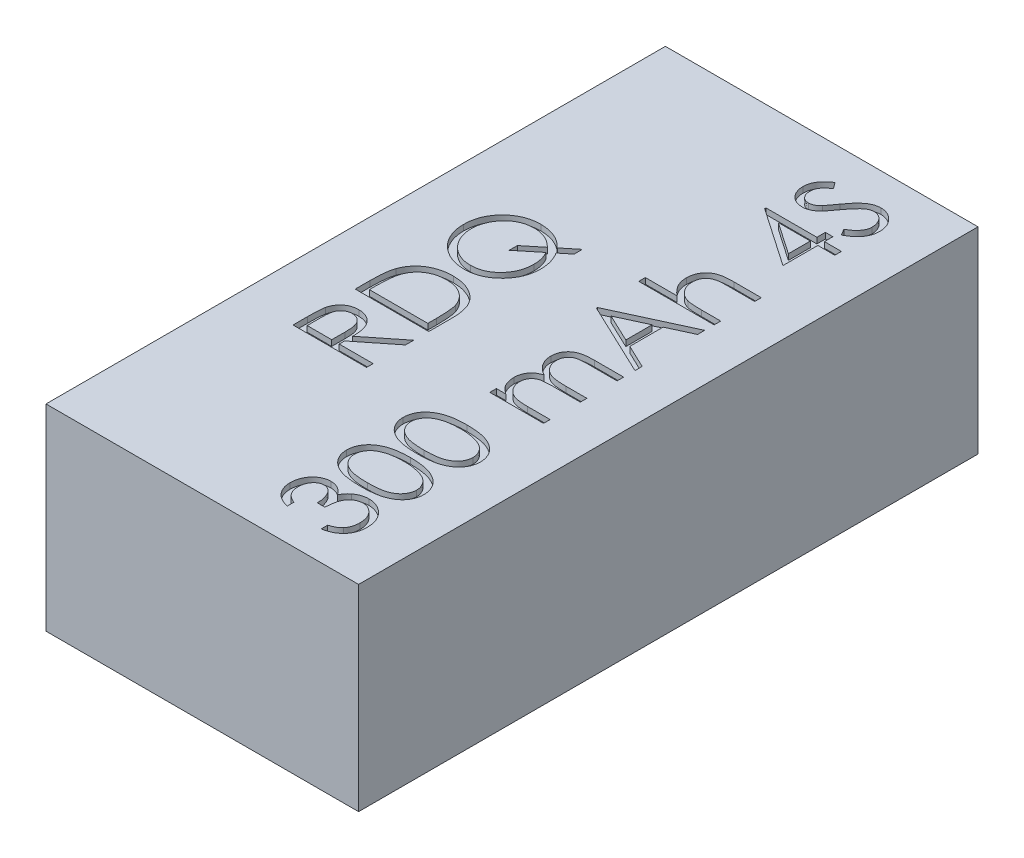
from build123d import *

# Parameters (mm, degrees)
SKETCH1_W           = 27
SKETCH1_H           = 17
BOSS_EXTRUDE1_DEPTH = 53.5
CUT_EXTRUDE1_DEPTH  = 0.5


with BuildPart() as part:
    # Sketch1 → Boss-Extrude1 (new body)
    with BuildSketch(Plane.XY):
        with Locations((13.5, 8.5)):
            Rectangle(SKETCH1_W, SKETCH1_H)
    extrude(amount=BOSS_EXTRUDE1_DEPTH)

    # Sketch2 → Cut-Extrude1 (cut)
    # profile 1 of 11: a face of its own
    with BuildSketch(Plane(origin=(0, 17, 0), x_dir=(1, 0, 0), z_dir=(0, 1, 0))):
        with BuildLine():
            Line((10.406206709, -19.747445913), (11.60191985, -18.771794872))
            Line((11.60191985, -18.771794872), (11.60191985, -19.48286258))
            Line((11.60191985, -19.48286258), (10.739479946, -20.187570112))
            add(Edge.make_bspline(
                [(10.739479946, -20.187570112), (10.782418115, -20.258253477), (10.867503496, -20.398318161), (10.977392537, -20.616638258), (11.06803695, -20.839707), (11.146009246, -21.065496785), (11.203793781, -21.296325169), (11.246365518, -21.530811258), (11.270512139, -21.769475586), (11.274349268, -21.929783476), (11.276278824, -22.010396635)],
                knots=[0, 0, 0, 0, 1.030168789, 2.04136103, 3.041061446, 4.02840172, 5.015006777, 6.002573162, 6.995564809, 8, 8, 8, 8], degree=3))
            add(Edge.make_bspline(
                [(11.276278824, -22.010396635), (11.273496896, -22.125894682), (11.268022889, -22.353160456), (11.220233775, -22.686934811), (11.14642769, -23.007307949), (11.039637627, -23.313641294), (10.903235123, -23.606268547), (10.735070294, -23.885053755), (10.537472418, -24.150138614), (10.311732858, -24.397610071), (10.06615966, -24.623897614), (9.803775776, -24.822450754), (9.528935149, -24.991274569), (9.240267237, -25.12777868), (8.940285096, -25.236112936), (8.626493868, -25.309939793), (8.300761509, -25.357727059), (8.07897747, -25.363232269), (7.966443087, -25.366025641)],
                knots=[0, 0, 0, 0, 1.055750571, 2.07740284, 3.077223765, 4.05828044, 5.038417088, 6.02463293, 7.030503776, 8.057169806, 9.083586829, 10.080154041, 11.061747002, 12.027853603, 12.995569715, 13.972756451, 14.971366004, 16, 16, 16, 16], degree=3))
            add(Edge.make_bspline(
                [(7.966443087, -25.366025641), (7.890910034, -25.365042274), (7.740374611, -25.363082448), (7.517034788, -25.33997161), (7.29764138, -25.306473604), (7.082736277, -25.257437263), (6.871816342, -25.195517113), (6.664986599, -25.118669394), (6.46230232, -25.028182825), (6.264961261, -24.924137817), (6.074652278, -24.809212849), (5.894685309, -24.682679828), (5.725163222, -24.546287519), (5.565669512, -24.40019703), (5.418398823, -24.242859139), (5.279607076, -24.077491459), (5.154569256, -23.899941739), (5.038493954, -23.714887828), (4.935670091, -23.521880677), (4.846796422, -23.322704854), (4.769732034, -23.119643795), (4.709209774, -22.910949503), (4.660281629, -22.698704214), (4.62668219, -22.48143921), (4.603496215, -22.259794893), (4.601596421, -22.110100199), (4.600637799, -22.034565304)],
                knots=[0, 0, 0, 0, 1.030594462, 2.053948123, 3.061601097, 4.058476009, 5.060194501, 6.06002193, 7.06782448, 8.087817635, 9.103219352, 10.100329444, 11.08825996, 12.071296, 13.049806814, 14.02795813, 15.015617367, 16.011298729, 17.008123238, 17.997713716, 18.986694736, 19.970122549, 20.961353313, 21.95757279, 22.969405538, 24, 24, 24, 24], degree=3))
            add(Edge.make_bspline(
                [(4.600637799, -22.034565304), (4.603405634, -21.919066735), (4.60884184, -21.692220154), (4.656639959, -21.359273962), (4.730735608, -21.039839872), (4.837005629, -20.734173507), (4.973661837, -20.442443145), (5.142000119, -20.165379482), (5.338128625, -19.900811605), (5.56399508, -19.65450724), (5.811294753, -19.430132681), (6.074192082, -19.230732299), (6.35260441, -19.063923676), (6.644362594, -18.926652713), (6.950112066, -18.820521203), (7.269925717, -18.746236596), (7.603336157, -18.698675844), (7.830595662, -18.693178436), (7.946090523, -18.690384615)],
                knots=[0, 0, 0, 0, 1.050621994, 2.063488829, 3.054696817, 4.03098776, 5.002868493, 5.980987983, 6.976572914, 7.995398336, 9.017077075, 10.011883961, 10.993309009, 11.965189742, 12.941480684, 13.932688673, 14.949378006, 16, 16, 16, 16], degree=3))
            add(Edge.make_bspline(
                [(7.946090523, -18.690384615), (8.006750826, -18.690977832), (8.126937047, -18.692153171), (8.305154379, -18.705785733), (8.479772419, -18.725373967), (8.650266553, -18.755281868), (8.817017405, -18.791322638), (8.979236862, -18.838193948), (9.138130919, -18.890627248), (9.344246905, -18.974947984), (9.594762943, -19.099191999), (9.881581448, -19.28161017), (10.155538793, -19.496654513), (10.321770783, -19.662968393), (10.406206709, -19.747445913)],
                knots=[0, 0, 0, 0, 0.791771681, 1.568736744, 2.332274839, 3.084898912, 3.827625132, 4.558351486, 5.288322611, 6.010973694, 7.464162711, 8.93230977, 10.441796527, 12, 12, 12, 12], degree=3))
        make_face()
        with BuildLine():
            add(Edge.make_bspline(
                [(9.936825699, -20.130328526), (9.866459833, -20.061048597), (9.728047054, -19.924771906), (9.501100655, -19.747867313), (9.265348533, -19.596256217), (9.017794377, -19.473424011), (8.760351686, -19.377503016), (8.492012681, -19.310194678), (8.214110715, -19.268359502), (8.025103686, -19.2629773), (7.929554065, -19.26025641)],
                knots=[0, 0, 0, 0, 1.052185505, 2.069695543, 3.06176622, 4.036333774, 5.010523718, 5.985353414, 6.981526144, 8, 8, 8, 8], degree=3))
            add(Edge.make_bspline(
                [(7.929554065, -19.26025641), (7.868019965, -19.260965986), (7.746377895, -19.262368691), (7.566368972, -19.281655862), (7.390335778, -19.308941473), (7.21859284, -19.348442675), (7.051488115, -19.399310516), (6.88924845, -19.462136769), (6.731350447, -19.535697362), (6.578774962, -19.621452941), (6.431743135, -19.715991211), (6.292053095, -19.821223903), (6.160425123, -19.935669808), (6.034690053, -20.058078656), (5.917439746, -20.190810488), (5.808724465, -20.333389278), (5.705913328, -20.484058134), (5.613113006, -20.643562626), (5.527797591, -20.807931958), (5.453919721, -20.976204341), (5.391347813, -21.146966844), (5.34061003, -21.319955033), (5.300672934, -21.494945059), (5.273417854, -21.672243715), (5.254150544, -21.851392507), (5.252664049, -21.97176033), (5.25191985, -22.032021234)],
                knots=[0, 0, 0, 0, 1.032958288, 2.041976502, 3.037103433, 4.023477888, 4.998866292, 5.968231228, 6.943073582, 7.921783703, 8.90545537, 9.876780072, 10.85618943, 11.833110341, 12.821898168, 13.827467856, 14.842673888, 15.88323808, 16.924703457, 17.951432745, 18.967462636, 19.976958182, 20.977218729, 21.979378626, 22.98839684, 24, 24, 24, 24], degree=3))
            add(Edge.make_bspline(
                [(5.25191985, -22.032021234), (5.252670105, -22.092704698), (5.254168686, -22.213915751), (5.273301032, -22.393934388), (5.30074079, -22.571621428), (5.340300314, -22.746306192), (5.391766313, -22.918053109), (5.45218511, -23.088192532), (5.526970747, -23.254426699), (5.609967846, -23.41807211), (5.703733242, -23.575441476), (5.807179674, -23.723811776), (5.916539015, -23.864867289), (6.035095472, -23.99634024), (6.163014821, -24.117714296), (6.296056544, -24.233567944), (6.439396527, -24.33734753), (6.589103208, -24.432974138), (6.745776686, -24.517830297), (6.906748473, -24.593353174), (7.072829486, -24.655606321), (7.242950622, -24.70634963), (7.416875656, -24.747882834), (7.595661067, -24.774637003), (7.778178075, -24.79407009), (7.901515391, -24.795453913), (7.963899017, -24.796153846)],
                knots=[0, 0, 0, 0, 1.013081393, 2.023560529, 3.020172014, 4.014894664, 5.012009234, 6.013339739, 7.027905139, 8.05406988, 9.076685265, 10.084431022, 11.073237316, 12.055989586, 13.037669622, 14.01702246, 15.000029851, 15.990179271, 16.982074564, 17.973767595, 18.957616416, 19.941159346, 20.937468857, 21.9410756, 22.95860252, 24, 24, 24, 24], degree=3))
            add(Edge.make_bspline(
                [(7.963899017, -24.796153846), (8.055614322, -24.793765382), (8.2360467, -24.789066534), (8.50098896, -24.750276283), (8.754875491, -24.684734781), (8.997961267, -24.594532223), (9.230611249, -24.479019366), (9.451737125, -24.337175248), (9.660349821, -24.16750518), (9.857792941, -23.977085381), (10.036596436, -23.767565232), (10.194185179, -23.545557419), (10.327177294, -23.312356558), (10.437353603, -23.069118633), (10.521452263, -22.814393974), (10.580693349, -22.549350232), (10.619354532, -22.273999289), (10.623098405, -22.086426668), (10.624996773, -21.991316106)],
                knots=[0, 0, 0, 0, 1.022486402, 2.011547069, 2.978383441, 3.941941744, 4.897799705, 5.869768277, 6.865262495, 7.891906405, 8.924879675, 9.932485585, 10.923702928, 11.914209426, 12.905618498, 13.909366795, 14.939923648, 16, 16, 16, 16], degree=3))
            add(Edge.make_bspline(
                [(10.624996773, -21.991316106), (10.624271322, -21.925971661), (10.622836431, -21.796724964), (10.603836454, -21.606080277), (10.576109227, -21.42040898), (10.537657398, -21.240203053), (10.483978671, -21.066183285), (10.422478846, -20.897026222), (10.348627307, -20.733199929), (10.290367575, -20.628993207), (10.26119469, -20.576812901)],
                knots=[0, 0, 0, 0, 1.060631832, 2.097854856, 3.10759029, 4.108271732, 5.086242299, 6.062102161, 7.029620145, 8, 8, 8, 8], degree=3))
            Line((10.26119469, -20.576812901), (8.508330106, -22.006580529))
            Line((8.508330106, -22.006580529), (8.508330106, -21.295512821))
            Line((8.508330106, -21.295512821), (9.936825699, -20.130328526))
        make_face(mode=Mode.SUBTRACT)
    # profile 2 of 11: a face of its own
    with BuildSketch(Plane(origin=(0, 17, 0), x_dir=(1, 0, 0), z_dir=(0, 1, 0))):
        with BuildLine():
            Line((11.113458312, -31.553205128), (4.763458312, -31.553205128))
            Line((4.763458312, -31.553205128), (4.763458312, -30.27099359))
            add(Edge.make_bspline(
                [(4.763458312, -30.27099359), (4.76426126, -30.159471283), (4.765812552, -29.944010765), (4.775648505, -29.632656754), (4.79304835, -29.344577642), (4.818393062, -29.080720883), (4.849513565, -28.840362113), (4.888521442, -28.624174352), (4.934582837, -28.43103975), (4.973853868, -28.31225948), (4.992424658, -28.256089744)],
                knots=[0, 0, 0, 0, 1.314313732, 2.53924729, 3.670748893, 4.714932338, 5.66265055, 6.526160246, 7.303039223, 8, 8, 8, 8], degree=3))
            add(Edge.make_bspline(
                [(4.992424658, -28.256089744), (5.020411648, -28.1826141), (5.075750977, -28.037328996), (5.180301116, -27.830583558), (5.298274409, -27.635292586), (5.432385748, -27.453013115), (5.580883864, -27.283287784), (5.742707889, -27.124190261), (5.921452674, -26.979643098), (6.113936668, -26.847394973), (6.317693608, -26.728123945), (6.532389794, -26.624459283), (6.756920052, -26.538363612), (6.990664006, -26.466893199), (7.234134526, -26.410566012), (7.487615412, -26.372135948), (7.750104794, -26.346788577), (7.928221322, -26.344241227), (8.018596533, -26.342948718)],
                knots=[0, 0, 0, 0, 0.984741985, 1.947153288, 2.898543998, 3.841229145, 4.778974371, 5.722123648, 6.681464302, 7.655713756, 8.646344578, 9.637374342, 10.639946623, 11.656849581, 12.698333139, 13.76849723, 14.867749466, 16, 16, 16, 16], degree=3))
            add(Edge.make_bspline(
                [(8.018596533, -26.342948718), (8.097084779, -26.344089846), (8.251754066, -26.346338557), (8.479702558, -26.366530303), (8.700888572, -26.395878815), (8.914259049, -26.441315978), (9.121682608, -26.496475433), (9.320951489, -26.567165305), (9.513882912, -26.648155026), (9.697907574, -26.742558303), (9.87214168, -26.846338355), (10.036511556, -26.957016667), (10.187369779, -27.077103338), (10.328669519, -27.203044165), (10.456636113, -27.337876194), (10.57360222, -27.479957866), (10.677609573, -27.629841346), (10.770292548, -27.788454458), (10.853176369, -27.957915518), (10.922311419, -28.143554936), (10.982189431, -28.344493374), (11.029822392, -28.561876733), (11.068238717, -28.794929674), (11.093816454, -29.044298692), (11.111162991, -29.309512511), (11.112678349, -29.491629808), (11.113458312, -29.585366587)],
                knots=[0, 0, 0, 0, 1.106010661, 2.179509527, 3.223302912, 4.248870533, 5.252098245, 6.246278179, 7.226402005, 8.199283979, 9.158616973, 10.083547221, 10.989831858, 11.874256832, 12.749262829, 13.607058236, 14.46581075, 15.317568432, 16.194266721, 17.121067875, 18.106207572, 19.147242834, 20.255495536, 21.43354536, 22.679031616, 24, 24, 24, 24], degree=3))
            Line((11.113458312, -29.585366587), (11.113458312, -31.553205128))
        make_face()
        with BuildLine():
            Line((10.46217626, -30.983333333), (10.46217626, -30.254457131))
            add(Edge.make_bspline(
                [(10.46217626, -30.254457131), (10.461726143, -30.149721373), (10.460860401, -29.948276153), (10.453263619, -29.658610929), (10.440850389, -29.393944024), (10.423478462, -29.154237857), (10.400493975, -28.93962777), (10.374867365, -28.749665253), (10.342940562, -28.584972998), (10.314000964, -28.485315306), (10.300627783, -28.439262821)],
                knots=[0, 0, 0, 0, 1.375205317, 2.645023457, 3.804390687, 4.853969522, 5.800190428, 6.637939096, 7.370582563, 8, 8, 8, 8], degree=3))
            add(Edge.make_bspline(
                [(10.300627783, -28.439262821), (10.280214245, -28.381299358), (10.239874747, -28.266756888), (10.166291507, -28.10187272), (10.079129669, -27.948098977), (9.982241944, -27.802757676), (9.872215539, -27.667903504), (9.751426342, -27.541964782), (9.619322497, -27.425095698), (9.476118215, -27.31909635), (9.323366374, -27.223085336), (9.160796821, -27.140663908), (8.990695038, -27.068885642), (8.811683955, -27.012050254), (8.625075628, -26.967238041), (8.429902412, -26.935827184), (8.226337013, -26.91632685), (8.087754976, -26.914002035), (8.017324498, -26.912820513)],
                knots=[0, 0, 0, 0, 0.998590647, 1.973329978, 2.929871262, 3.868367705, 4.809062953, 5.754642869, 6.701828697, 7.672172887, 8.647399344, 9.630604387, 10.631475358, 11.644913558, 12.679592956, 13.747988925, 14.855477812, 16, 16, 16, 16], degree=3))
            add(Edge.make_bspline(
                [(8.017324498, -26.912820513), (7.943059469, -26.913751763), (7.797165163, -26.915581211), (7.58309633, -26.938576032), (7.377210007, -26.972179425), (7.179492424, -27.020772684), (6.989557842, -27.08269585), (6.808456731, -27.1599747), (6.634276469, -27.248269852), (6.471037262, -27.353323049), (6.31665405, -27.468377054), (6.17522156, -27.596062635), (6.046417616, -27.734351191), (5.928236291, -27.881734418), (5.825432194, -28.042366012), (5.733472072, -28.212461994), (5.655428955, -28.394517712), (5.613920161, -28.521177889), (5.592825299, -28.585546875)],
                knots=[0, 0, 0, 0, 1.122418816, 2.205001699, 3.251619955, 4.274784885, 5.280384055, 6.268708349, 7.249350384, 8.229342522, 9.199999885, 10.157847722, 11.105861043, 12.055065948, 13.010012805, 13.98527497, 14.976112212, 16, 16, 16, 16], degree=3))
            add(Edge.make_bspline(
                [(5.592825299, -28.585546875), (5.57809978, -28.638798241), (5.546789286, -28.752025254), (5.512634681, -28.936791139), (5.482509376, -29.144735767), (5.457004076, -29.376782368), (5.438702793, -29.632666429), (5.424966265, -29.912584749), (5.415701375, -30.216658317), (5.41506872, -30.427446629), (5.414740363, -30.536848958)],
                knots=[0, 0, 0, 0, 0.674548936, 1.434276114, 2.292660221, 3.240891867, 4.284742987, 5.42552168, 6.663806718, 8, 8, 8, 8], degree=3))
            Line((5.414740363, -30.536848958), (5.414740363, -30.983333333))
            Line((5.414740363, -30.983333333), (10.46217626, -30.983333333))
        make_face(mode=Mode.SUBTRACT)
    # profile 3 of 11: a face of its own
    with BuildSketch(Plane(origin=(0, 17, 0), x_dir=(1, 0, 0), z_dir=(0, 1, 0))):
        with BuildLine():
            Line((4.763458312, -36.926282051), (4.763458312, -35.65551883))
            add(Edge.make_bspline(
                [(4.763458312, -35.65551883), (4.763740589, -35.570717068), (4.764282593, -35.407888292), (4.767304763, -35.174619644), (4.775966808, -34.962661911), (4.783420953, -34.772125917), (4.797013475, -34.603015157), (4.810004934, -34.454811073), (4.827011433, -34.32819625), (4.842805558, -34.251550206), (4.849956709, -34.216846955)],
                knots=[0, 0, 0, 0, 1.410062039, 2.707475311, 3.878576406, 4.937260626, 5.877586885, 6.699081471, 7.410979367, 8, 8, 8, 8], degree=3))
            add(Edge.make_bspline(
                [(4.849956709, -34.216846955), (4.8614353, -34.170389259), (4.884147612, -34.078464935), (4.93215244, -33.946112148), (4.987706842, -33.819995237), (5.052949273, -33.700626649), (5.128400204, -33.588646463), (5.212622773, -33.482742364), (5.305446869, -33.383258121), (5.407709272, -33.291492084), (5.517231133, -33.208136302), (5.633711863, -33.135020443), (5.75666984, -33.073238885), (5.88629658, -33.024756221), (6.021160161, -32.984073938), (6.162637067, -32.956740456), (6.310255006, -32.939714367), (6.410696274, -32.938032356), (6.461625379, -32.937179487)],
                knots=[0, 0, 0, 0, 1.02737844, 2.032840108, 3.019645024, 3.985760442, 4.950801802, 5.916702504, 6.889791722, 7.870143693, 8.864820395, 9.842884691, 10.820524757, 11.815201459, 12.812418953, 13.84314332, 14.906358105, 16, 16, 16, 16], degree=3))
            add(Edge.make_bspline(
                [(6.461625379, -32.937179487), (6.546234783, -32.939844669), (6.711329645, -32.94504513), (6.950925815, -32.993532104), (7.174426429, -33.072955219), (7.381550072, -33.1823989), (7.568259386, -33.321771377), (7.732253498, -33.489274927), (7.86948591, -33.685002994), (7.964650285, -33.867210467), (8.025597419, -34.028163372), (8.068480527, -34.160666668), (8.10161295, -34.305205327), (8.131294903, -34.460394491), (8.153704406, -34.626879981), (8.170117513, -34.804262766), (8.180375573, -34.992669356), (8.18190321, -35.12209881), (8.182689081, -35.188681891)],
                knots=[0, 0, 0, 0, 1.260483769, 2.459530307, 3.627416485, 4.787058657, 5.939039949, 7.08810263, 8.267026773, 9.491475466, 10.141966685, 10.831826277, 11.566392101, 12.351337768, 13.187381173, 14.07005841, 15.007169909, 16, 16, 16, 16], degree=3))
            Line((8.182689081, -35.188681891), (11.113458312, -32.855769231))
            Line((11.113458312, -32.855769231), (11.113458312, -33.560476763))
            Line((11.113458312, -33.560476763), (8.182689081, -35.893389423))
            Line((8.182689081, -35.893389423), (8.182689081, -36.356410256))
            Line((8.182689081, -36.356410256), (11.113458312, -36.356410256))
            Line((11.113458312, -36.356410256), (11.113458312, -36.926282051))
            Line((11.113458312, -36.926282051), (4.763458312, -36.926282051))
        make_face()
        with BuildLine():
            Line((5.414740363, -36.356410256), (7.53140703, -36.356410256))
            Line((7.53140703, -36.356410256), (7.540311276, -35.193770032))
            add(Edge.make_bspline(
                [(7.540311276, -35.193770032), (7.540335305, -35.139486526), (7.540381881, -35.03426963), (7.53313584, -34.882049948), (7.524893606, -34.74031742), (7.512283362, -34.609615999), (7.49604154, -34.489881227), (7.475693126, -34.381192825), (7.452087902, -34.283308531), (7.415173946, -34.169516855), (7.359244545, -34.040948623), (7.272376138, -33.904277837), (7.167997356, -33.784360188), (7.045194876, -33.68669617), (6.91231885, -33.604869633), (6.76800838, -33.549803629), (6.616944757, -33.513104475), (6.513152283, -33.509092276), (6.460353344, -33.507051282)],
                knots=[0, 0, 0, 0, 1.146477201, 2.22219935, 3.21835465, 4.145220026, 4.995151787, 5.769831222, 6.480173269, 7.120302478, 8.295254187, 9.430763426, 10.528629691, 11.636497428, 12.733230534, 13.811001502, 14.886462612, 16, 16, 16, 16], degree=3))
            add(Edge.make_bspline(
                [(6.460353344, -33.507051282), (6.409291581, -33.509238568), (6.308105799, -33.513572971), (6.159897603, -33.548766308), (6.01997531, -33.608932837), (5.88815826, -33.688082173), (5.770372464, -33.787414927), (5.668498962, -33.901650577), (5.585101475, -34.030767139), (5.529672484, -34.150381204), (5.497121482, -34.258151084), (5.473462394, -34.35127662), (5.457042105, -34.45701696), (5.441489098, -34.574891231), (5.428898518, -34.705124388), (5.420213708, -34.848098134), (5.415127492, -35.002926791), (5.414872409, -35.110235738), (5.414740363, -35.165785256)],
                knots=[0, 0, 0, 0, 1.100823979, 2.181431445, 3.263702604, 4.376021382, 5.48638238, 6.575013887, 7.666064109, 8.791843368, 9.405226397, 10.093019944, 10.863016055, 11.711746407, 12.658404307, 13.684961631, 14.801597923, 16, 16, 16, 16], degree=3))
            Line((5.414740363, -35.165785256), (5.414740363, -36.356410256))
        make_face(mode=Mode.SUBTRACT)
    # profile 4 of 11: a face of its own
    with BuildSketch(Plane(origin=(0, 17, 0), x_dir=(1, 0, 0), z_dir=(0, 1, 0))):
        with BuildLine():
            Line((21.716052462, -6.519551282), (21.394227542, -5.982752404))
            add(Edge.make_bspline(
                [(21.394227542, -5.982752404), (21.477801498, -5.932826459), (21.637925972, -5.837170276), (21.854294131, -5.677601381), (22.038194044, -5.512260242), (22.188555889, -5.339922452), (22.306936012, -5.161639946), (22.390760061, -4.976248877), (22.443040473, -4.784373992), (22.44939063, -4.653792915), (22.452560876, -4.588601763)],
                knots=[0, 0, 0, 0, 1.272034388, 2.437168799, 3.508375237, 4.49857839, 5.41946034, 6.295179144, 7.148887113, 8, 8, 8, 8], degree=3))
            add(Edge.make_bspline(
                [(22.452560876, -4.588601763), (22.450973366, -4.532938301), (22.447826123, -4.422585358), (22.418806984, -4.259809641), (22.371331732, -4.102512865), (22.306973888, -3.95225866), (22.227864105, -3.813027776), (22.134578825, -3.688977979), (22.026791023, -3.584231077), (21.908493728, -3.497394629), (21.781639354, -3.430201216), (21.65093394, -3.379415782), (21.514584111, -3.350973203), (21.422758594, -3.346705147), (21.376419049, -3.344551282)],
                knots=[0, 0, 0, 0, 1.09553864, 2.171907928, 3.244545276, 4.325730702, 5.384330216, 6.391480148, 7.371786628, 8.333890167, 9.27165687, 10.191402356, 11.087295184, 12, 12, 12, 12], degree=3))
            add(Edge.make_bspline(
                [(21.376419049, -3.344551282), (21.323531575, -3.347168654), (21.216428674, -3.352469116), (21.05814056, -3.399182445), (20.900819742, -3.470511744), (20.803488352, -3.537553268), (20.753121773, -3.572245593)],
                knots=[0, 0, 0, 0, 0.938992559, 1.901562324, 2.914110574, 4, 4, 4, 4], degree=3))
            add(Edge.make_bspline(
                [(20.753121773, -3.572245593), (20.716746509, -3.600672396), (20.640381192, -3.660350915), (20.526805578, -3.763035585), (20.409415042, -3.882915614), (20.285632449, -4.018350253), (20.156485921, -4.169566682), (20.020967664, -4.336623408), (19.881847008, -4.520946164), (19.788663081, -4.650321685), (19.740581709, -4.717077324)],
                knots=[0, 0, 0, 0, 0.72225051, 1.516274602, 2.393638633, 3.3469932, 4.386926276, 5.505032946, 6.712638081, 8, 8, 8, 8], degree=3))
            add(Edge.make_bspline(
                [(19.740581709, -4.717077324), (19.692995557, -4.783886574), (19.602014459, -4.911620773), (19.466987543, -5.090252772), (19.343536523, -5.249990584), (19.230499244, -5.390124228), (19.127860375, -5.510592068), (19.036605543, -5.612343399), (18.954266797, -5.69278621), (18.900851791, -5.737518478), (18.87686977, -5.757602163)],
                knots=[0, 0, 0, 0, 1.452282411, 2.77665338, 3.964542531, 5.026858415, 5.96415736, 6.766646006, 7.446254459, 8, 8, 8, 8], degree=3))
            add(Edge.make_bspline(
                [(18.87686977, -5.757602163), (18.839491748, -5.785669076), (18.765982851, -5.840866427), (18.651119905, -5.913806084), (18.533762678, -5.975316295), (18.41348584, -6.024820515), (18.291193345, -6.064852703), (18.165967067, -6.092685343), (18.038657117, -6.109840793), (17.953001303, -6.111612902), (17.910122975, -6.1125)],
                knots=[0, 0, 0, 0, 1.068019517, 2.100403715, 3.106014851, 4.09224787, 5.069873182, 6.043214339, 7.020455327, 8, 8, 8, 8], degree=3))
            add(Edge.make_bspline(
                [(17.910122975, -6.1125), (17.842940253, -6.110132083), (17.710010791, -6.105446863), (17.515828191, -6.065820395), (17.330425731, -6.003282416), (17.15568166, -5.915640282), (16.995986464, -5.802767729), (16.849902736, -5.671578134), (16.725418147, -5.516770838), (16.618348321, -5.345387653), (16.53367701, -5.158780931), (16.472315416, -4.96232463), (16.4358674, -4.757430942), (16.430782174, -4.618427674), (16.428201901, -4.547896635)],
                knots=[0, 0, 0, 0, 1.005248779, 1.989011071, 2.95484373, 3.928844559, 4.904706341, 5.875556129, 6.859318422, 7.868909462, 8.894684146, 9.918924798, 10.944050749, 12, 12, 12, 12], degree=3))
            add(Edge.make_bspline(
                [(16.428201901, -4.547896635), (16.430747771, -4.473055937), (16.435810695, -4.324221675), (16.480927048, -4.105644298), (16.552731766, -3.894338771), (16.636977513, -3.725110835), (16.720583307, -3.592384223), (16.796900527, -3.491264834), (16.884578226, -3.38823847), (16.985464785, -3.284412358), (17.097542371, -3.178761517), (17.221759731, -3.0717726), (17.356997463, -2.962444376), (17.453566044, -2.892134124), (17.503071693, -2.856089744)],
                knots=[0, 0, 0, 0, 1.286507425, 2.558452658, 3.822738219, 5.118007103, 5.800084425, 6.519418873, 7.295692132, 8.12638276, 9.008892966, 9.945018126, 10.946518512, 12, 12, 12, 12], degree=3))
            Line((17.503071693, -2.856089744), (17.893586517, -3.371264022))
            add(Edge.make_bspline(
                [(17.893586517, -3.371264022), (17.853509002, -3.402369375), (17.776329079, -3.462271011), (17.668280543, -3.553250391), (17.569448958, -3.638870708), (17.483831799, -3.723872957), (17.405017717, -3.801705187), (17.338737628, -3.878587678), (17.282897395, -3.951553524), (17.223196755, -4.043306058), (17.165807597, -4.159535501), (17.115397968, -4.304222452), (17.085492286, -4.455937246), (17.081503328, -4.559214957), (17.079483953, -4.611498397)],
                knots=[0, 0, 0, 0, 1.181392137, 2.275085037, 3.289537922, 4.225335853, 5.084247276, 5.86831218, 6.587234301, 7.222706459, 8.415108401, 9.595592188, 10.782789524, 12, 12, 12, 12], degree=3))
            add(Edge.make_bspline(
                [(17.079483953, -4.611498397), (17.081646325, -4.67711214), (17.085816258, -4.803642061), (17.132556564, -4.982859002), (17.203622051, -5.145095056), (17.306097743, -5.284156891), (17.428268505, -5.398978091), (17.567595655, -5.483066054), (17.721477071, -5.53334077), (17.828768457, -5.539494307), (17.883410235, -5.542628205)],
                knots=[0, 0, 0, 0, 1.144248881, 2.206576175, 3.214949548, 4.222996039, 5.203671638, 6.127710127, 7.046472867, 8, 8, 8, 8], degree=3))
            add(Edge.make_bspline(
                [(17.883410235, -5.542628205), (17.917422973, -5.541874215), (17.985922261, -5.540355733), (18.08664253, -5.520951979), (18.186831733, -5.49471651), (18.286137257, -5.454496279), (18.386807809, -5.398486275), (18.490265278, -5.325013147), (18.597400789, -5.232455825), (18.667082913, -5.161559651), (18.703872975, -5.124128606)],
                knots=[0, 0, 0, 0, 0.858259122, 1.72847414, 2.583651051, 3.473048463, 4.427392529, 5.488649985, 6.674082839, 8, 8, 8, 8], degree=3))
            add(Edge.make_bspline(
                [(18.703872975, -5.124128606), (18.716277293, -5.110228687), (18.745747114, -5.077205663), (18.793993109, -5.016833626), (18.85350671, -4.937108835), (18.927143699, -4.840113127), (19.012562923, -4.724058056), (19.108672191, -4.588930862), (19.218591523, -4.436237795), (19.295440204, -4.327885176), (19.336074498, -4.270592949)],
                knots=[0, 0, 0, 0, 0.420754252, 0.999615792, 1.744751191, 2.668019286, 3.750313428, 4.999500688, 6.413464383, 8, 8, 8, 8], degree=3))
            add(Edge.make_bspline(
                [(19.336074498, -4.270592949), (19.386223857, -4.201675698), (19.48333114, -4.068226992), (19.629227681, -3.878347583), (19.771918845, -3.706185354), (19.910484134, -3.55112312), (20.04390346, -3.411671637), (20.173678539, -3.289236659), (20.298958324, -3.183262666), (20.458482578, -3.067616009), (20.656218731, -2.950847167), (20.898592016, -2.850727482), (21.141660838, -2.787033053), (21.30482119, -2.778760904), (21.385323296, -2.774679487)],
                knots=[0, 0, 0, 0, 1.163604038, 2.253157948, 3.268574773, 4.215621239, 5.091738613, 5.902582348, 6.650434646, 7.330118262, 8.591011492, 9.77460283, 10.902005569, 12, 12, 12, 12], degree=3))
            add(Edge.make_bspline(
                [(21.385323296, -2.774679487), (21.442252012, -2.775872939), (21.555003928, -2.778236666), (21.72057548, -2.805362367), (21.881344586, -2.84519662), (22.03516501, -2.90475214), (22.184504843, -2.978627187), (22.326550813, -3.071023598), (22.464062565, -3.178682906), (22.593184934, -3.302117604), (22.711865027, -3.437114378), (22.817000174, -3.580310236), (22.906681298, -3.730210341), (22.978103518, -3.888438012), (23.034339997, -4.053293462), (23.074972047, -4.225320324), (23.099937328, -4.404692859), (23.102526527, -4.526614422), (23.103842927, -4.588601763)],
                knots=[0, 0, 0, 0, 0.983922938, 1.948738757, 2.895227473, 3.844781104, 4.796118043, 5.772795661, 6.770647148, 7.813532943, 8.8582745, 9.876489951, 10.882905461, 11.874265028, 12.874055871, 13.891769171, 14.928133632, 16, 16, 16, 16], degree=3))
            add(Edge.make_bspline(
                [(23.103842927, -4.588601763), (23.102915497, -4.636563028), (23.101072318, -4.731881535), (23.084777711, -4.87286874), (23.061723389, -5.011007702), (23.025121884, -5.144565068), (22.980713572, -5.275261418), (22.926034335, -5.402528907), (22.860506239, -5.526427014), (22.785589774, -5.647658485), (22.698381753, -5.765882497), (22.596899769, -5.880118363), (22.483731582, -5.993371311), (22.357128937, -6.104837964), (22.215699644, -6.212086469), (22.061550349, -6.317691519), (21.894222646, -6.421138454), (21.776551805, -6.486134291), (21.716052462, -6.519551282)],
                knots=[0, 0, 0, 0, 0.915313873, 1.819100311, 2.706792138, 3.586475221, 4.459428225, 5.3405999, 6.2277379, 7.133009489, 8.059106158, 9.028520402, 10.047404263, 11.114294124, 12.246039232, 13.433834781, 14.680630578, 16, 16, 16, 16], degree=3))
        make_face()
    # profile 5 of 11: a face of its own
    with BuildSketch(Plane(origin=(0, 17, 0), x_dir=(1, 0, 0), z_dir=(0, 1, 0))):
        Polygon((16.428201901, -7.856460337), (16.428201901, -7.740705128), (20.824355748, -7.740705128), (20.824355748, -7.008012821), (21.475637799, -7.008012821), (21.475637799, -7.740705128), (22.941022414, -7.740705128), (22.941022414, -8.310576923), (21.475637799, -8.310576923), (21.475637799, -11.32275641), align=None)
        Polygon((20.824355748, -8.310576923), (18.066583312, -8.310576923), (20.824355748, -10.203365385), align=None, mode=Mode.SUBTRACT)
    # profile 6 of 11: a face of its own
    with BuildSketch(Plane(origin=(0, 17, 0), x_dir=(1, 0, 0), z_dir=(0, 1, 0))):
        with BuildLine():
            Line((16.428201901, -18.731089744), (16.428201901, -18.161217949))
            Line((16.428201901, -18.161217949), (19.17707009, -18.161217949))
            add(Edge.make_bspline(
                [(19.17707009, -18.161217949), (19.100617437, -18.10003953), (18.951760202, -17.980922015), (18.757402471, -17.780527676), (18.589315149, -17.574212792), (18.453733265, -17.356585528), (18.347671021, -17.129545003), (18.274515429, -16.892765533), (18.227868485, -16.647202315), (18.222133027, -16.480222236), (18.219227542, -16.395633013)],
                knots=[0, 0, 0, 0, 1.125633083, 2.191665293, 3.205031882, 4.182434329, 5.134135993, 6.080017564, 7.027370072, 8, 8, 8, 8], degree=3))
            add(Edge.make_bspline(
                [(18.219227542, -16.395633013), (18.222210225, -16.309718411), (18.22805098, -16.14147852), (18.279664009, -15.897443119), (18.360866051, -15.668127513), (18.476162063, -15.456908656), (18.618555583, -15.266063877), (18.784669918, -15.099023214), (18.974528867, -14.960075435), (19.150958377, -14.866976171), (19.307923684, -14.806013126), (19.44261949, -14.767468287), (19.592697755, -14.734772633), (19.758097523, -14.706289956), (19.939607775, -14.687305686), (20.136411147, -14.67205741), (20.348495894, -14.661214384), (20.49530835, -14.660794192), (20.571220731, -14.660576923)],
                knots=[0, 0, 0, 0, 1.235771509, 2.41991536, 3.57472251, 4.727526861, 5.870395018, 6.992794988, 8.106410512, 9.245194824, 9.854018721, 10.52826073, 11.259975989, 12.064917182, 12.943387139, 13.886414983, 14.90712766, 16, 16, 16, 16], degree=3))
            Line((20.571220731, -14.660576923), (22.941022414, -14.660576923))
            Line((22.941022414, -14.660576923), (22.941022414, -15.230448718))
            Line((22.941022414, -15.230448718), (20.758209914, -15.230448718))
            add(Edge.make_bspline(
                [(20.758209914, -15.230448718), (20.695031561, -15.230792602), (20.574182124, -15.231450393), (20.40116181, -15.233651518), (20.244652894, -15.238453366), (20.10433049, -15.246499795), (19.980384764, -15.254596384), (19.872613264, -15.266075235), (19.781692075, -15.279330932), (19.726964872, -15.291249345), (19.702420651, -15.296594551)],
                knots=[0, 0, 0, 0, 1.430934443, 2.737134061, 3.918973087, 4.976914145, 5.92044225, 6.731742364, 7.431207999, 8, 8, 8, 8], degree=3))
            add(Edge.make_bspline(
                [(19.702420651, -15.296594551), (19.630351332, -15.31722527), (19.492164526, -15.356782924), (19.304787886, -15.450562383), (19.143597123, -15.564972926), (19.013093427, -15.706761012), (18.910692094, -15.870979751), (18.839827434, -16.059434018), (18.79583063, -16.270218518), (18.791405693, -16.418721434), (18.789099337, -16.496123798)],
                knots=[0, 0, 0, 0, 1.090133324, 2.090238182, 3.036763777, 3.954757083, 4.878717367, 5.838952881, 6.873623762, 8, 8, 8, 8], degree=3))
            add(Edge.make_bspline(
                [(18.789099337, -16.496123798), (18.789950196, -16.541970834), (18.791634023, -16.632700933), (18.808967289, -16.767168367), (18.836342844, -16.898013113), (18.876778978, -17.024883985), (18.925941671, -17.148039784), (18.98627413, -17.267981125), (19.059222567, -17.383066537), (19.141325308, -17.494781437), (19.232152643, -17.598777025), (19.328035616, -17.695526302), (19.430133565, -17.781774786), (19.536814016, -17.859913422), (19.649538778, -17.927365479), (19.767221201, -17.986244636), (19.890015947, -18.036202258), (19.975242131, -18.061026571), (20.017885395, -18.073447516)],
                knots=[0, 0, 0, 0, 1.024369801, 2.02720137, 3.025498567, 4.008789058, 4.999724648, 5.987391013, 7.005161842, 8.042127274, 9.083588116, 10.088924978, 11.084112559, 12.068088063, 13.041783903, 14.016724555, 15.007660144, 16, 16, 16, 16], degree=3))
            add(Edge.make_bspline(
                [(20.017885395, -18.073447516), (20.048766263, -18.080594763), (20.116059476, -18.096169493), (20.227047178, -18.113069261), (20.356018167, -18.128196407), (20.502776827, -18.14098449), (20.667860938, -18.148827804), (20.850143964, -18.157279183), (21.050767716, -18.16042518), (21.190278137, -18.160945795), (21.263207911, -18.161217949)],
                knots=[0, 0, 0, 0, 0.607992626, 1.324890765, 2.152360218, 3.099583803, 4.150613268, 5.323148443, 6.60066238, 8, 8, 8, 8], degree=3))
            Line((21.263207911, -18.161217949), (22.941022414, -18.161217949))
            Line((22.941022414, -18.161217949), (22.941022414, -18.731089744))
            Line((22.941022414, -18.731089744), (16.428201901, -18.731089744))
        make_face()
    # profile 7 of 11: a face of its own
    with BuildSketch(Plane(origin=(0, 17, 0), x_dir=(1, 0, 0), z_dir=(0, 1, 0))):
        Polygon((16.591022414, -22.475961538), (22.941022414, -19.545192308), (22.941022414, -20.164673478), (20.905766004, -21.103435497), (20.905766004, -23.982051282), (22.941022414, -24.947526042), (22.941022414, -25.569551282), (16.591022414, -22.557371795), align=None)
        Polygon((17.828712719, -22.523026843), (20.254483953, -23.672946715), (20.254483953, -21.403635817), align=None, mode=Mode.SUBTRACT)
    # profile 8 of 11: a face of its own
    with BuildSketch(Plane(origin=(0, 17, 0), x_dir=(1, 0, 0), z_dir=(0, 1, 0))):
        with BuildLine():
            Line((18.300637799, -33.466346154), (18.300637799, -32.896474359))
            Line((18.300637799, -32.896474359), (19.107108151, -32.896474359))
            add(Edge.make_bspline(
                [(19.107108151, -32.896474359), (19.036554931, -32.845159193), (18.901368197, -32.746834415), (18.723222967, -32.585606731), (18.572041887, -32.424541498), (18.492679819, -32.308548077), (18.454554065, -32.252824519)],
                knots=[0, 0, 0, 0, 1.134379233, 2.173579362, 3.122582517, 4, 4, 4, 4], degree=3))
            add(Edge.make_bspline(
                [(18.454554065, -32.252824519), (18.418258616, -32.176870061), (18.346301844, -32.026288157), (18.273306672, -31.787856135), (18.228448274, -31.543880663), (18.222313497, -31.379128617), (18.219227542, -31.296254006)],
                knots=[0, 0, 0, 0, 1.014936303, 2.012140481, 3.000054389, 4, 4, 4, 4], degree=3))
            add(Edge.make_bspline(
                [(18.219227542, -31.296254006), (18.221124028, -31.240205314), (18.224877071, -31.129287965), (18.249296989, -30.964942111), (18.291510108, -30.805543123), (18.350300157, -30.652022994), (18.42152705, -30.507409124), (18.504996402, -30.374726357), (18.598880216, -30.256182118), (18.705873962, -30.149876511), (18.831915069, -30.055125345), (18.979420766, -29.968578483), (19.150517078, -29.887546298), (19.274576237, -29.842917261), (19.339890603, -29.819421074)],
                knots=[0, 0, 0, 0, 1.009731074, 1.9982035, 2.985760524, 3.974587072, 4.955028184, 5.885388378, 6.793242796, 7.673688873, 8.594941726, 9.625945874, 10.750113716, 12, 12, 12, 12], degree=3))
            add(Edge.make_bspline(
                [(19.339890603, -29.819421074), (19.295033931, -29.794544491), (19.206762299, -29.745590871), (19.081826762, -29.6634), (18.964999918, -29.577256117), (18.856039762, -29.486564369), (18.755813635, -29.39094388), (18.662276839, -29.291935301), (18.578019952, -29.187321401), (18.479431811, -29.042620394), (18.374376293, -28.854549006), (18.285586499, -28.616501567), (18.229040839, -28.369816905), (18.222520256, -28.202120114), (18.219227542, -28.117437901)],
                knots=[0, 0, 0, 0, 0.861026002, 1.694378253, 2.508904292, 3.297437177, 4.073006284, 4.833627155, 5.583069468, 6.325614666, 7.772320565, 9.187282923, 10.579656144, 12, 12, 12, 12], degree=3))
            add(Edge.make_bspline(
                [(18.219227542, -28.117437901), (18.222124887, -28.039625156), (18.227795271, -27.88733806), (18.273374953, -27.666008832), (18.348813496, -27.458713062), (18.454903581, -27.267647873), (18.587586886, -27.09503346), (18.745641225, -26.944420477), (18.928489336, -26.819120464), (19.099127612, -26.73535398), (19.250058802, -26.679589411), (19.379243524, -26.644762177), (19.521542356, -26.614589115), (19.676840846, -26.589006909), (19.845453425, -26.570512146), (20.027457564, -26.556763356), (20.22301142, -26.547470732), (20.357931561, -26.54681327), (20.427480748, -26.546474359)],
                knots=[0, 0, 0, 0, 1.209392158, 2.366897878, 3.497663982, 4.628180075, 5.751982922, 6.871462727, 8.009245026, 9.185977379, 9.818124946, 10.509294143, 11.264649411, 12.079922034, 12.956003306, 13.901808055, 14.918415426, 16, 16, 16, 16], degree=3))
            Line((20.427480748, -26.546474359), (22.941022414, -26.546474359))
            Line((22.941022414, -26.546474359), (22.941022414, -27.116346154))
            Line((22.941022414, -27.116346154), (20.424936677, -27.116346154))
            add(Edge.make_bspline(
                [(20.424936677, -27.116346154), (20.36557212, -27.11648677), (20.251482469, -27.116757012), (20.087739886, -27.121653049), (19.938477784, -27.130831335), (19.803501339, -27.14172814), (19.682852907, -27.156457489), (19.576870351, -27.175904821), (19.485070112, -27.196343744), (19.383342581, -27.230379986), (19.27121777, -27.284286911), (19.151178487, -27.367894204), (19.045870948, -27.471652746), (18.954448466, -27.592122694), (18.880060153, -27.72916864), (18.826949048, -27.880240358), (18.794067872, -28.044366404), (18.790791399, -28.157982259), (18.789099337, -28.216656651)],
                knots=[0, 0, 0, 0, 1.253367865, 2.408782419, 3.458086102, 4.410454771, 5.267690823, 6.022776742, 6.685072793, 7.251272234, 8.28433411, 9.300106008, 10.325693114, 11.39283262, 12.482417211, 13.60372085, 14.762494729, 16, 16, 16, 16], degree=3))
            add(Edge.make_bspline(
                [(18.789099337, -28.216656651), (18.792385561, -28.288570585), (18.798874595, -28.430573057), (18.847660999, -28.63907179), (18.928746647, -28.837298177), (19.039644617, -29.0239139), (19.175875834, -29.194000854), (19.337085614, -29.340864642), (19.519703245, -29.462093744), (19.688686674, -29.544201433), (19.840488035, -29.59607424), (19.973109449, -29.630305707), (20.124246492, -29.657093698), (20.292126976, -29.681730564), (20.478180408, -29.698357519), (20.681257963, -29.713045609), (20.902749821, -29.72000789), (21.056287296, -29.720973178), (21.136004385, -29.721474359)],
                knots=[0, 0, 0, 0, 1.091136677, 2.154576964, 3.231646693, 4.331257757, 5.439166191, 6.528231045, 7.628049365, 8.756709726, 9.369482423, 10.061167346, 10.833871401, 11.698739631, 12.636505159, 13.668922441, 14.789697963, 16, 16, 16, 16], degree=3))
            Line((21.136004385, -29.721474359), (22.941022414, -29.721474359))
            Line((22.941022414, -29.721474359), (22.941022414, -30.291346154))
            Line((22.941022414, -30.291346154), (20.581397014, -30.291346154))
            add(Edge.make_bspline(
                [(20.581397014, -30.291346154), (20.51482485, -30.291490265), (20.386746698, -30.291767519), (20.203079884, -30.296623121), (20.036018505, -30.305851714), (19.885756677, -30.316520684), (19.752567645, -30.331869943), (19.63573687, -30.349304557), (19.535558772, -30.369894908), (19.425676162, -30.40398232), (19.304647145, -30.456096971), (19.175489607, -30.539821902), (19.062649504, -30.644794694), (18.96482751, -30.766575345), (18.884893043, -30.904665675), (18.829339195, -31.057538474), (18.795445872, -31.222689583), (18.791254745, -31.336792215), (18.789099337, -31.395472756)],
                knots=[0, 0, 0, 0, 1.320285835, 2.540097241, 3.643286278, 4.638464947, 5.527188413, 6.301437306, 6.980978976, 7.552872752, 8.580906713, 9.583871393, 10.589652407, 11.624542289, 12.671761011, 13.738681301, 14.837052193, 16, 16, 16, 16], degree=3))
            add(Edge.make_bspline(
                [(18.789099337, -31.395472756), (18.791876038, -31.464445008), (18.797409904, -31.601904257), (18.847219667, -31.80383809), (18.925241865, -31.998846821), (19.033479807, -32.183825691), (19.167561476, -32.353762542), (19.325221675, -32.502603873), (19.504356195, -32.627260555), (19.670845751, -32.710793881), (19.818889144, -32.76434699), (19.945255499, -32.799458151), (20.085305744, -32.830276662), (20.23933008, -32.852926204), (20.406641022, -32.874859919), (20.588097227, -32.885432836), (20.783535478, -32.895724112), (20.918468581, -32.896218142), (20.988448296, -32.896474359)],
                knots=[0, 0, 0, 0, 1.09880202, 2.189873405, 3.297736452, 4.440485332, 5.596193377, 6.739822772, 7.886349079, 9.066114917, 9.699498033, 10.395421758, 11.156987371, 11.985484089, 12.878178647, 13.847820956, 14.883825601, 16, 16, 16, 16], degree=3))
            Line((20.988448296, -32.896474359), (22.941022414, -32.896474359))
            Line((22.941022414, -32.896474359), (22.941022414, -33.466346154))
            Line((22.941022414, -33.466346154), (18.300637799, -33.466346154))
        make_face()
    # profile 9 of 11: a face of its own
    with BuildSketch(Plane(origin=(0, 17, 0), x_dir=(1, 0, 0), z_dir=(0, 1, 0))):
        with BuildLine():
            add(Edge.make_bspline(
                [(19.768566485, -41.200320513), (19.666789796, -41.199725394), (19.46908711, -41.198569368), (19.181006402, -41.185708947), (18.910749877, -41.164345112), (18.658304602, -41.135067305), (18.423605396, -41.099438403), (18.207279494, -41.051876006), (18.008325587, -40.99778711), (17.82609518, -40.935098946), (17.658132202, -40.864364492), (17.501334217, -40.787374735), (17.355926682, -40.701085287), (17.219630901, -40.61038901), (17.094528493, -40.511755108), (16.979178043, -40.40729848), (16.874552322, -40.294929979), (16.780579682, -40.175739477), (16.69817939, -40.050534783), (16.625151401, -39.922737272), (16.564998635, -39.790063488), (16.515792018, -39.654260007), (16.47562352, -39.515040606), (16.448031877, -39.372440826), (16.43070213, -39.226130111), (16.429043218, -39.127376515), (16.428201901, -39.07729367)],
                knots=[0, 0, 0, 0, 1.646148282, 3.197666765, 4.66315463, 6.030252048, 7.307778049, 8.501004361, 9.610818041, 10.641065266, 11.615491391, 12.557119604, 13.464013759, 14.348536654, 15.203310953, 16.038349431, 16.863300206, 17.683791446, 18.490318933, 19.285717724, 20.06220424, 20.843281102, 21.620494212, 22.403315558, 23.190242141, 24, 24, 24, 24], degree=3))
            add(Edge.make_bspline(
                [(16.428201901, -39.07729367), (16.428902669, -39.026767667), (16.43029695, -38.926238705), (16.449922294, -38.778147365), (16.475253294, -38.632635523), (16.515880046, -38.491910882), (16.564495223, -38.353312608), (16.628642177, -38.220287365), (16.698406971, -38.088138655), (16.783514152, -37.962869818), (16.877571592, -37.840738052), (16.984350832, -37.726252272), (17.100896745, -37.616485917), (17.229808646, -37.515584818), (17.369109934, -37.419224495), (17.519968353, -37.331062883), (17.682049582, -37.249266381), (17.854602235, -37.172297433), (18.042235462, -37.10499012), (18.243778944, -37.045148538), (18.461057754, -36.996098236), (18.692861513, -36.955534499), (18.940338572, -36.924049318), (19.202987515, -36.901134935), (19.480972659, -36.889026675), (19.671033388, -36.886746854), (19.768566485, -36.885576923)],
                knots=[0, 0, 0, 0, 0.810910589, 1.61342667, 2.396193133, 3.181089899, 3.963115317, 4.752255436, 5.550715454, 6.36105385, 7.181178335, 8.024612154, 8.872680183, 9.750181803, 10.651284446, 11.591556747, 12.554036451, 13.566402641, 14.62422919, 15.753422176, 16.94128843, 18.199818041, 19.531985927, 20.947085226, 22.433341622, 24, 24, 24, 24], degree=3))
            add(Edge.make_bspline(
                [(19.768566485, -36.885576923), (19.865673296, -36.886772594), (20.055305493, -36.889107524), (20.332052876, -36.900875246), (20.593286084, -36.92460901), (20.839283631, -36.953863861), (21.07015957, -36.994880975), (21.285763463, -37.044303206), (21.486858646, -37.100612487), (21.672004298, -37.168952787), (21.84425752, -37.244130221), (22.005146976, -37.325838948), (22.155965555, -37.41350305), (22.295634272, -37.508418192), (22.424028742, -37.610979011), (22.540974387, -37.72066843), (22.648432788, -37.836153805), (22.743526462, -37.958997578), (22.829281605, -38.085433217), (22.901578124, -38.217595352), (22.964218817, -38.3521016), (23.01543336, -38.490294876), (23.055150837, -38.631961818), (23.082454439, -38.777573394), (23.101646775, -38.926259604), (23.103108341, -39.026774658), (23.103842927, -39.07729367)],
                knots=[0, 0, 0, 0, 1.561645053, 3.049612875, 4.452756685, 5.778837748, 7.032101753, 8.221335837, 9.334924186, 10.387562255, 11.392109817, 12.355697819, 13.287721948, 14.19548756, 15.068665045, 15.927346723, 16.771751757, 17.602390507, 18.423119567, 19.225778204, 20.022010933, 20.807278863, 21.593079439, 22.384715467, 23.188155646, 24, 24, 24, 24], degree=3))
            add(Edge.make_bspline(
                [(23.103842927, -39.07729367), (23.102996825, -39.12737542), (23.101328477, -39.226126854), (23.08406785, -39.372453398), (23.056317436, -39.514480115), (23.017461601, -39.652907861), (22.969900383, -39.788446802), (22.907935898, -39.919250147), (22.83657245, -40.046771778), (22.755301552, -40.17067335), (22.662186318, -40.288619487), (22.559211252, -40.401301234), (22.443735724, -40.505783621), (22.317577775, -40.603562278), (22.181079209, -40.695217378), (22.034148425, -40.780761171), (21.876534535, -40.859365461), (21.707244131, -40.931308402), (21.523720335, -40.995093845), (21.324259277, -41.051218807), (21.106835024, -41.096044091), (20.872551486, -41.134040448), (20.620932614, -41.164487427), (20.351887377, -41.185700075), (20.065926669, -41.198559604), (19.869495318, -41.199722832), (19.768566485, -41.200320513)],
                knots=[0, 0, 0, 0, 0.810927267, 1.598990287, 2.382942141, 3.152806972, 3.926217614, 4.706701772, 5.493896336, 6.292070767, 7.104102563, 7.925577746, 8.761822141, 9.623241997, 10.509042271, 11.423174113, 12.375371989, 13.360203808, 14.400680605, 15.520553799, 16.714061498, 17.994519714, 19.364400916, 20.818312473, 22.365209998, 24, 24, 24, 24], degree=3))
        make_face()
        with BuildLine():
            add(Edge.make_bspline(
                [(19.766022414, -40.630448718), (19.850837571, -40.630227255), (20.015447137, -40.629797439), (20.254230404, -40.618893749), (20.477317756, -40.603716926), (20.684622127, -40.584623608), (20.875418992, -40.55602865), (21.050501564, -40.523585922), (21.209545769, -40.484672849), (21.353941463, -40.438404676), (21.485733349, -40.385700723), (21.608434146, -40.328258302), (21.723498089, -40.266001988), (21.830646014, -40.197655662), (21.928568157, -40.121868068), (22.01974662, -40.04215273), (22.101010297, -39.954918514), (22.198489623, -39.834267089), (22.299215561, -39.674976667), (22.386929674, -39.47428032), (22.442052007, -39.268053082), (22.449061981, -39.128078696), (22.452560876, -39.058213141)],
                knots=[0, 0, 0, 0, 1.459098681, 2.831824031, 4.11146945, 5.306290378, 6.412266529, 7.42953815, 8.369053297, 9.227277979, 10.03601793, 10.809473603, 11.557037441, 12.285528272, 12.993193355, 13.685654407, 14.36688038, 15.041354379, 16.352855396, 17.594313975, 18.799247529, 20, 20, 20, 20], degree=3))
            add(Edge.make_bspline(
                [(22.452560876, -39.058213141), (22.449497175, -38.987943161), (22.443380641, -38.847652464), (22.389997945, -38.641614666), (22.303214633, -38.443247041), (22.204066755, -38.286697414), (22.10904047, -38.167927741), (22.028114836, -38.082799832), (21.937475593, -38.004674942), (21.839688267, -37.930575202), (21.732876371, -37.862613888), (21.617555809, -37.800813581), (21.493405699, -37.744419519), (21.406737748, -37.712290248), (21.362426661, -37.695863381)],
                knots=[0, 0, 0, 0, 1.353621445, 2.702441307, 4.075953605, 5.516772412, 6.261413105, 7.007624062, 7.778524365, 8.566925914, 9.372323995, 10.217594641, 11.088702136, 12, 12, 12, 12], degree=3))
            add(Edge.make_bspline(
                [(21.362426661, -37.695863381), (21.305766991, -37.67671946), (21.190723561, -37.637849089), (21.012263793, -37.587753441), (20.825024492, -37.548301074), (20.630124638, -37.512807539), (20.426126894, -37.488581281), (20.213662455, -37.469081677), (19.992571126, -37.457596002), (19.842357357, -37.456172239), (19.766022414, -37.455448718)],
                knots=[0, 0, 0, 0, 0.884706709, 1.796334032, 2.740027952, 3.714592787, 4.726048262, 5.777819803, 6.87074269, 8, 8, 8, 8], degree=3))
            add(Edge.make_bspline(
                [(19.766022414, -37.455448718), (19.689699818, -37.456446918), (19.540396505, -37.458399612), (19.321742092, -37.465863561), (19.114064868, -37.48513776), (18.916470155, -37.506544734), (18.730051744, -37.53810826), (18.553249062, -37.572140295), (18.38825238, -37.617862445), (18.232478746, -37.666702781), (18.08769694, -37.72260104), (17.953235493, -37.78413595), (17.828432875, -37.849845305), (17.713674691, -37.921248758), (17.608295292, -37.997351729), (17.514719451, -38.080882842), (17.42839522, -38.166537255), (17.331619383, -38.288355885), (17.232166235, -38.446541083), (17.143133087, -38.644734666), (17.090440868, -38.84985648), (17.083133624, -38.988810998), (17.079483953, -39.058213141)],
                knots=[0, 0, 0, 0, 1.313483664, 2.569454835, 3.763100662, 4.901599063, 5.988328865, 7.015709358, 7.99797933, 8.932480776, 9.824041341, 10.666387587, 11.475829342, 12.24921787, 12.990555181, 13.709176526, 14.405678811, 15.080244297, 16.38186033, 17.610124501, 18.806354173, 20, 20, 20, 20], degree=3))
            add(Edge.make_bspline(
                [(17.079483953, -39.058213141), (17.083142704, -39.128455884), (17.090466873, -39.269069335), (17.142889402, -39.476381659), (17.231905742, -39.67591416), (17.331427775, -39.834620994), (17.428024172, -39.954959732), (17.510238827, -40.040354924), (17.599239534, -40.121175805), (17.698030358, -40.195000887), (17.804800747, -40.262941939), (17.918376712, -40.327604238), (18.041306774, -40.384278502), (18.172995318, -40.437151658), (18.317398954, -40.483497006), (18.477018636, -40.521965454), (18.652519317, -40.556986426), (18.844710254, -40.582207234), (19.052058869, -40.604415831), (19.275716729, -40.618727135), (19.515319956, -40.629847389), (19.680781185, -40.63024426), (19.766022414, -40.630448718)],
                knots=[0, 0, 0, 0, 1.207546505, 2.417292871, 3.651582144, 4.952510111, 5.626719005, 6.30238548, 6.989136872, 7.692112372, 8.420316868, 9.164734959, 9.937886623, 10.746308695, 11.604196049, 12.543341915, 13.568754172, 14.680483261, 15.875568977, 17.154711427, 18.534182925, 20, 20, 20, 20], degree=3))
        make_face(mode=Mode.SUBTRACT)
    # profile 10 of 11: a face of its own
    with BuildSketch(Plane(origin=(0, 17, 0), x_dir=(1, 0, 0), z_dir=(0, 1, 0))):
        with BuildLine():
            add(Edge.make_bspline(
                [(19.768566485, -46.084935897), (19.666789796, -46.084340779), (19.46908711, -46.083184752), (19.181006402, -46.070324331), (18.910749877, -46.048960496), (18.658304602, -46.01968269), (18.423605396, -45.984053787), (18.207279494, -45.936491391), (18.008325587, -45.882402495), (17.82609518, -45.819714331), (17.658132202, -45.748979876), (17.501334217, -45.67199012), (17.355926682, -45.585700672), (17.219630901, -45.495004395), (17.094528493, -45.396370493), (16.979178043, -45.291913865), (16.874552322, -45.179545364), (16.780579682, -45.060354862), (16.69817939, -44.935150168), (16.625151401, -44.807352657), (16.564998635, -44.674678873), (16.515792018, -44.538875392), (16.47562352, -44.39965599), (16.448031877, -44.257056211), (16.43070213, -44.110745496), (16.429043218, -44.0119919), (16.428201901, -43.961909054)],
                knots=[0, 0, 0, 0, 1.646148282, 3.197666765, 4.66315463, 6.030252048, 7.307778049, 8.501004361, 9.610818041, 10.641065266, 11.615491391, 12.557119604, 13.464013759, 14.348536654, 15.203310953, 16.038349431, 16.863300206, 17.683791446, 18.490318933, 19.285717724, 20.06220424, 20.843281102, 21.620494212, 22.403315558, 23.190242141, 24, 24, 24, 24], degree=3))
            add(Edge.make_bspline(
                [(16.428201901, -43.961909054), (16.428902669, -43.911383052), (16.43029695, -43.81085409), (16.449922294, -43.66276275), (16.475253294, -43.517250908), (16.515880046, -43.376526266), (16.564495223, -43.237927993), (16.628642177, -43.104902749), (16.698406971, -42.972754039), (16.783514152, -42.847485203), (16.877571592, -42.725353436), (16.984350832, -42.610867656), (17.100896745, -42.501101301), (17.229808646, -42.400200202), (17.369109934, -42.30383988), (17.519968353, -42.215678268), (17.682049582, -42.133881766), (17.854602235, -42.056912817), (18.042235462, -41.989605504), (18.243778944, -41.929763923), (18.461057754, -41.880713621), (18.692861513, -41.840149884), (18.940338572, -41.808664702), (19.202987515, -41.785750319), (19.480972659, -41.77364206), (19.671033388, -41.771362239), (19.768566485, -41.770192308)],
                knots=[0, 0, 0, 0, 0.810910589, 1.61342667, 2.396193133, 3.181089899, 3.963115317, 4.752255436, 5.550715454, 6.36105385, 7.181178335, 8.024612154, 8.872680183, 9.750181803, 10.651284446, 11.591556747, 12.554036451, 13.566402641, 14.62422919, 15.753422176, 16.94128843, 18.199818041, 19.531985927, 20.947085226, 22.433341622, 24, 24, 24, 24], degree=3))
            add(Edge.make_bspline(
                [(19.768566485, -41.770192308), (19.865673296, -41.771387978), (20.055305493, -41.773722908), (20.332052876, -41.785490631), (20.593286084, -41.809224395), (20.839283631, -41.838479246), (21.07015957, -41.87949636), (21.285763463, -41.92891859), (21.486858646, -41.985227872), (21.672004298, -42.053568171), (21.84425752, -42.128745605), (22.005146976, -42.210454333), (22.155965555, -42.298118435), (22.295634272, -42.393033577), (22.424028742, -42.495594396), (22.540974387, -42.605283815), (22.648432788, -42.72076919), (22.743526462, -42.843612963), (22.829281605, -42.970048602), (22.901578124, -43.102210737), (22.964218817, -43.236716984), (23.01543336, -43.37491026), (23.055150837, -43.516577202), (23.082454439, -43.662188779), (23.101646775, -43.810874988), (23.103108341, -43.911390042), (23.103842927, -43.961909054)],
                knots=[0, 0, 0, 0, 1.561645053, 3.049612875, 4.452756685, 5.778837748, 7.032101753, 8.221335837, 9.334924186, 10.387562255, 11.392109817, 12.355697819, 13.287721948, 14.19548756, 15.068665045, 15.927346723, 16.771751757, 17.602390507, 18.423119567, 19.225778204, 20.022010933, 20.807278863, 21.593079439, 22.384715467, 23.188155646, 24, 24, 24, 24], degree=3))
            add(Edge.make_bspline(
                [(23.103842927, -43.961909054), (23.102996825, -44.011990804), (23.101328477, -44.110742239), (23.08406785, -44.257068783), (23.056317436, -44.3990955), (23.017461601, -44.537523245), (22.969900383, -44.673062187), (22.907935898, -44.803865531), (22.83657245, -44.931387163), (22.755301552, -45.055288734), (22.662186318, -45.173234872), (22.559211252, -45.285916619), (22.443735724, -45.390399005), (22.317577775, -45.488177662), (22.181079209, -45.579832762), (22.034148425, -45.665376555), (21.876534535, -45.743980846), (21.707244131, -45.815923786), (21.523720335, -45.87970923), (21.324259277, -45.935834192), (21.106835024, -45.980659476), (20.872551486, -46.018655833), (20.620932614, -46.049102812), (20.351887377, -46.07031546), (20.065926669, -46.083174989), (19.869495318, -46.084338217), (19.768566485, -46.084935897)],
                knots=[0, 0, 0, 0, 0.810927267, 1.598990287, 2.382942141, 3.152806972, 3.926217614, 4.706701772, 5.493896336, 6.292070767, 7.104102563, 7.925577746, 8.761822141, 9.623241997, 10.509042271, 11.423174113, 12.375371989, 13.360203808, 14.400680605, 15.520553799, 16.714061498, 17.994519714, 19.364400916, 20.818312473, 22.365209998, 24, 24, 24, 24], degree=3))
        make_face()
        with BuildLine():
            add(Edge.make_bspline(
                [(19.766022414, -45.515064103), (19.850837571, -45.514842639), (20.015447137, -45.514412823), (20.254230404, -45.503509134), (20.477317756, -45.48833231), (20.684622127, -45.469238993), (20.875418992, -45.440644035), (21.050501564, -45.408201306), (21.209545769, -45.369288234), (21.353941463, -45.32302006), (21.485733349, -45.270316107), (21.608434146, -45.212873687), (21.723498089, -45.150617372), (21.830646014, -45.082271046), (21.928568157, -45.006483453), (22.01974662, -44.926768115), (22.101010297, -44.839533899), (22.198489623, -44.718882474), (22.299215561, -44.559592052), (22.386929674, -44.358895705), (22.442052007, -44.152668466), (22.449061981, -44.012694081), (22.452560876, -43.942828526)],
                knots=[0, 0, 0, 0, 1.459098681, 2.831824031, 4.11146945, 5.306290378, 6.412266529, 7.42953815, 8.369053297, 9.227277979, 10.03601793, 10.809473603, 11.557037441, 12.285528272, 12.993193355, 13.685654407, 14.36688038, 15.041354379, 16.352855396, 17.594313975, 18.799247529, 20, 20, 20, 20], degree=3))
            add(Edge.make_bspline(
                [(22.452560876, -43.942828526), (22.449497175, -43.872558546), (22.443380641, -43.732267849), (22.389997945, -43.526230051), (22.303214633, -43.327862425), (22.204066755, -43.171312798), (22.10904047, -43.052543126), (22.028114836, -42.967415216), (21.937475593, -42.889290326), (21.839688267, -42.815190586), (21.732876371, -42.747229273), (21.617555809, -42.685428965), (21.493405699, -42.629034904), (21.406737748, -42.596905633), (21.362426661, -42.580478766)],
                knots=[0, 0, 0, 0, 1.353621445, 2.702441307, 4.075953605, 5.516772412, 6.261413105, 7.007624062, 7.778524365, 8.566925914, 9.372323995, 10.217594641, 11.088702136, 12, 12, 12, 12], degree=3))
            add(Edge.make_bspline(
                [(21.362426661, -42.580478766), (21.305766991, -42.561334844), (21.190723561, -42.522464474), (21.012263793, -42.472368826), (20.825024492, -42.432916459), (20.630124638, -42.397422924), (20.426126894, -42.373196665), (20.213662455, -42.353697061), (19.992571126, -42.342211386), (19.842357357, -42.340787624), (19.766022414, -42.340064103)],
                knots=[0, 0, 0, 0, 0.884706709, 1.796334032, 2.740027952, 3.714592787, 4.726048262, 5.777819803, 6.87074269, 8, 8, 8, 8], degree=3))
            add(Edge.make_bspline(
                [(19.766022414, -42.340064103), (19.689699818, -42.341062303), (19.540396505, -42.343014997), (19.321742092, -42.350478946), (19.114064868, -42.369753145), (18.916470155, -42.391160119), (18.730051744, -42.422723644), (18.553249062, -42.45675568), (18.38825238, -42.502477829), (18.232478746, -42.551318166), (18.08769694, -42.607216425), (17.953235493, -42.668751334), (17.828432875, -42.73446069), (17.713674691, -42.805864142), (17.608295292, -42.881967113), (17.514719451, -42.965498227), (17.42839522, -43.051152639), (17.331619383, -43.172971269), (17.232166235, -43.331156467), (17.143133087, -43.52935005), (17.090440868, -43.734471865), (17.083133624, -43.873426383), (17.079483953, -43.942828526)],
                knots=[0, 0, 0, 0, 1.313483664, 2.569454835, 3.763100662, 4.901599063, 5.988328865, 7.015709358, 7.99797933, 8.932480776, 9.824041341, 10.666387587, 11.475829342, 12.24921787, 12.990555181, 13.709176526, 14.405678811, 15.080244297, 16.38186033, 17.610124501, 18.806354173, 20, 20, 20, 20], degree=3))
            add(Edge.make_bspline(
                [(17.079483953, -43.942828526), (17.083142704, -44.013071269), (17.090466873, -44.15368472), (17.142889402, -44.360997044), (17.231905742, -44.560529545), (17.331427775, -44.719236379), (17.428024172, -44.839575117), (17.510238827, -44.924970308), (17.599239534, -45.005791189), (17.698030358, -45.079616272), (17.804800747, -45.147557324), (17.918376712, -45.212219622), (18.041306774, -45.268893887), (18.172995318, -45.321767043), (18.317398954, -45.368112391), (18.477018636, -45.406580838), (18.652519317, -45.441601811), (18.844710254, -45.466822619), (19.052058869, -45.489031216), (19.275716729, -45.50334252), (19.515319956, -45.514462773), (19.680781185, -45.514859645), (19.766022414, -45.515064103)],
                knots=[0, 0, 0, 0, 1.207546505, 2.417292871, 3.651582144, 4.952510111, 5.626719005, 6.30238548, 6.989136872, 7.692112372, 8.420316868, 9.164734959, 9.937886623, 10.746308695, 11.604196049, 12.543341915, 13.568754172, 14.680483261, 15.875568977, 17.154711427, 18.534182925, 20, 20, 20, 20], degree=3))
        make_face(mode=Mode.SUBTRACT)
    # profile 11 of 11: a face of its own
    with BuildSketch(Plane(origin=(0, 17, 0), x_dir=(1, 0, 0), z_dir=(0, 1, 0))):
        with BuildLine():
            Line((18.05640703, -50.155448718), (18.05640703, -50.725320513))
            add(Edge.make_bspline(
                [(18.05640703, -50.725320513), (17.992485237, -50.709881757), (17.867523362, -50.679700251), (17.688984474, -50.616748939), (17.520031799, -50.54817029), (17.363828923, -50.465821486), (17.217236628, -50.375998461), (17.083579788, -50.273087237), (16.959459122, -50.161835741), (16.849307962, -50.038781904), (16.749562654, -49.90973419), (16.664517907, -49.772874237), (16.591358372, -49.630955558), (16.53108738, -49.482994874), (16.48568393, -49.328551677), (16.452742297, -49.169022217), (16.431349847, -49.003988439), (16.429262034, -48.891960667), (16.428201901, -48.835076122)],
                knots=[0, 0, 0, 0, 1.162005537, 2.271625781, 3.343758855, 4.383309926, 5.390229558, 6.379919256, 7.361854164, 8.333198761, 9.295911338, 10.242430842, 11.177959212, 12.116337295, 13.062827104, 14.020064771, 14.994644689, 16, 16, 16, 16], degree=3))
            add(Edge.make_bspline(
                [(16.428201901, -48.835076122), (16.430704219, -48.752194575), (16.435654272, -48.58823937), (16.480856178, -48.34736927), (16.552384632, -48.115092041), (16.651215537, -47.89395012), (16.77311252, -47.688539536), (16.9181914, -47.505775311), (17.083652989, -47.348134727), (17.266410642, -47.215883499), (17.461728495, -47.112333144), (17.662751637, -47.035976438), (17.869003213, -46.989491388), (18.008262849, -46.983466949), (18.078031629, -46.980448718)],
                knots=[0, 0, 0, 0, 1.083050992, 2.142477498, 3.193116406, 4.255571735, 5.30263384, 6.308962982, 7.297363603, 8.282367274, 9.249857812, 10.179914175, 11.08814088, 12, 12, 12, 12], degree=3))
            add(Edge.make_bspline(
                [(18.078031629, -46.980448718), (18.145172528, -46.982559805), (18.276556848, -46.986690873), (18.46836585, -47.021767739), (18.649144182, -47.080797816), (18.819652862, -47.162567243), (18.978810786, -47.268415484), (19.126976045, -47.396635948), (19.264805803, -47.548133634), (19.343762561, -47.662939708), (19.384411837, -47.722045272)],
                knots=[0, 0, 0, 0, 1.024540389, 2.004866551, 2.965041327, 3.920577974, 4.882998113, 5.874504559, 6.905732034, 8, 8, 8, 8], degree=3))
            add(Edge.make_bspline(
                [(19.384411837, -47.722045272), (19.416911133, -47.654410132), (19.48140599, -47.520188182), (19.609899982, -47.339083601), (19.754616109, -47.172172062), (19.868811522, -47.080182728), (19.926298856, -47.033874199)],
                knots=[0, 0, 0, 0, 1.015663554, 2.015584519, 3.001021554, 4, 4, 4, 4], degree=3))
            add(Edge.make_bspline(
                [(19.926298856, -47.033874199), (19.968132206, -47.003319192), (20.051113854, -46.942709538), (20.184529941, -46.867896498), (20.319424786, -46.800025676), (20.459413994, -46.74713885), (20.602875033, -46.706183406), (20.750054238, -46.676908033), (20.901071793, -46.658721377), (21.003238721, -46.656116876), (21.054594129, -46.654807692)],
                knots=[0, 0, 0, 0, 1.025084078, 2.033381695, 3.024893161, 4.013698104, 4.991890475, 5.976764909, 6.982997093, 8, 8, 8, 8], degree=3))
            add(Edge.make_bspline(
                [(21.054594129, -46.654807692), (21.143511311, -46.658063922), (21.320927231, -46.664561057), (21.583052472, -46.722618554), (21.839249299, -46.812658589), (22.084416285, -46.940381656), (22.313582625, -47.096744308), (22.520139267, -47.280711843), (22.694903828, -47.494914302), (22.842693296, -47.731588615), (22.959730839, -47.989106426), (23.044087246, -48.263417255), (23.094684147, -48.552933629), (23.100755242, -48.750919405), (23.103842927, -48.85161258)],
                knots=[0, 0, 0, 0, 0.955697303, 1.906897079, 2.875188111, 3.870982192, 4.871999088, 5.854111427, 6.836107184, 7.836239895, 8.848948182, 9.870701427, 10.917064451, 12, 12, 12, 12], degree=3))
            add(Edge.make_bspline(
                [(23.103842927, -48.85161258), (23.102254001, -48.919497609), (23.099127525, -49.053072708), (23.078134872, -49.249518201), (23.03875112, -49.43663725), (22.989220601, -49.616246857), (22.920739109, -49.785636276), (22.839096484, -49.947242014), (22.742199109, -50.1003557), (22.629884029, -50.244068038), (22.504164092, -50.378225493), (22.362950739, -50.499410175), (22.2088795, -50.608962866), (22.04056448, -50.706187481), (21.858477104, -50.791493199), (21.661887715, -50.863044237), (21.452320361, -50.925517131), (21.30631726, -50.954619597), (21.23140703, -50.969551282)],
                knots=[0, 0, 0, 0, 1.048603596, 2.063302207, 3.045874044, 3.999447474, 4.937100059, 5.862643889, 6.7929026, 7.7308982, 8.676022965, 9.627908155, 10.600123445, 11.591992905, 12.626222643, 13.701663232, 14.820785756, 16, 16, 16, 16], degree=3))
            Line((21.23140703, -50.969551282), (21.23140703, -50.399679487))
            add(Edge.make_bspline(
                [(21.23140703, -50.399679487), (21.280300239, -50.384832658), (21.375401779, -50.355954287), (21.512272048, -50.306797489), (21.637744516, -50.250793624), (21.752739609, -50.190714353), (21.858389825, -50.127616316), (21.951901501, -50.057013523), (22.03738194, -49.984135217), (22.08554145, -49.929199818), (22.109111356, -49.902313702)],
                knots=[0, 0, 0, 0, 1.198163088, 2.33053128, 3.407730985, 4.417276592, 5.372219308, 6.28897303, 7.162600585, 8, 8, 8, 8], degree=3))
            add(Edge.make_bspline(
                [(22.109111356, -49.902313702), (22.136510888, -49.866755942), (22.191225375, -49.795750181), (22.261247962, -49.680115989), (22.321185622, -49.558078752), (22.369905464, -49.428620767), (22.406476335, -49.291724668), (22.432798327, -49.147945762), (22.450174931, -48.997048144), (22.451753961, -48.894063468), (22.452560876, -48.841436298)],
                knots=[0, 0, 0, 0, 0.946083416, 1.889246487, 2.84504177, 3.809995578, 4.801312957, 5.829064617, 6.89060985, 8, 8, 8, 8], degree=3))
            add(Edge.make_bspline(
                [(22.452560876, -48.841436298), (22.451443448, -48.782012086), (22.449258413, -48.66581317), (22.429163917, -48.496259353), (22.399898738, -48.334955841), (22.354699469, -48.183693533), (22.29885421, -48.040491041), (22.22873496, -47.907355763), (22.14646668, -47.78253997), (22.05295992, -47.667642334), (21.950595208, -47.564326914), (21.843528636, -47.473359511), (21.732211631, -47.396026197), (21.616028183, -47.333644562), (21.495459411, -47.284385706), (21.370166963, -47.2508519), (21.241176209, -47.227535579), (21.153493651, -47.225636726), (21.109291645, -47.224679487)],
                knots=[0, 0, 0, 0, 1.217147791, 2.380027433, 3.494444702, 4.572153297, 5.609568379, 6.639424714, 7.649109417, 8.668170816, 9.669597737, 10.625200337, 11.543417969, 12.441394052, 13.322311151, 14.205496177, 15.095365482, 16, 16, 16, 16], degree=3))
            add(Edge.make_bspline(
                [(21.109291645, -47.224679487), (21.050129143, -47.227461734), (20.932098523, -47.233012383), (20.758382816, -47.275213298), (20.590948586, -47.345252676), (20.431964405, -47.441383049), (20.286412941, -47.561264912), (20.15561777, -47.699230389), (20.04779451, -47.859032846), (19.973229758, -48.00600242), (19.922365124, -48.136208335), (19.888482782, -48.247632583), (19.859792482, -48.372376953), (19.83310016, -48.508931539), (19.810382874, -48.658325683), (19.791438432, -48.820396613), (19.776280002, -48.995177211), (19.769510729, -49.116174041), (19.766022414, -49.178525641)],
                knots=[0, 0, 0, 0, 1.070505987, 2.135685285, 3.216438728, 4.346150463, 5.486482244, 6.621737109, 7.7759408, 8.963942283, 9.59839197, 10.305095457, 11.070459627, 11.915156775, 12.823989992, 13.805807174, 14.869297358, 16, 16, 16, 16], degree=3))
            Line((19.766022414, -49.178525641), (19.114740363, -49.178525641))
            add(Edge.make_bspline(
                [(19.114740363, -49.178525641), (19.113215062, -49.099993345), (19.110228418, -48.94622166), (19.081354216, -48.721005791), (19.034999768, -48.506559692), (18.968767265, -48.305966081), (18.890753375, -48.12348524), (18.800610479, -47.964532522), (18.698583279, -47.833292423), (18.586625197, -47.728393834), (18.467201424, -47.648663538), (18.341968337, -47.591323814), (18.210429471, -47.557149288), (18.120626579, -47.552604786), (18.075487558, -47.550320513)],
                knots=[0, 0, 0, 0, 1.322091412, 2.58874672, 3.817242262, 5.011895168, 6.140903042, 7.155122731, 8.080855046, 8.929742606, 9.727943956, 10.488587771, 11.240295418, 12, 12, 12, 12], degree=3))
            add(Edge.make_bspline(
                [(18.075487558, -47.550320513), (18.042320989, -47.551055918), (17.976337671, -47.552518972), (17.879635076, -47.571703307), (17.785892923, -47.599206082), (17.696180033, -47.639136805), (17.610312793, -47.690873233), (17.527349247, -47.753277532), (17.448361399, -47.828128246), (17.372941745, -47.911961856), (17.304330732, -48.004793014), (17.244284742, -48.104456288), (17.193347206, -48.210547553), (17.151203994, -48.322387222), (17.119537368, -48.440496477), (17.096791106, -48.564276883), (17.082572102, -48.69397654), (17.08052473, -48.782462317), (17.079483953, -48.82744391)],
                knots=[0, 0, 0, 0, 0.884325644, 1.759323928, 2.622595547, 3.489424008, 4.37295195, 5.294616785, 6.255907374, 7.274251867, 8.302369084, 9.333474657, 10.37669385, 11.44084034, 12.520297356, 13.637342342, 14.798947025, 16, 16, 16, 16], degree=3))
            add(Edge.make_bspline(
                [(17.079483953, -48.82744391), (17.082008281, -48.899746222), (17.086938881, -49.040969454), (17.130124348, -49.244559374), (17.199027443, -49.433824452), (17.281274492, -49.578493175), (17.362464565, -49.685322989), (17.43337118, -49.761662576), (17.512170732, -49.836629788), (17.603716641, -49.905292659), (17.701809246, -49.974732588), (17.811435068, -50.037950578), (17.92973447, -50.099381734), (18.013365121, -50.136397789), (18.05640703, -50.155448718)],
                knots=[0, 0, 0, 0, 1.472543308, 2.876219568, 4.221790263, 5.565193594, 6.249813518, 6.953379497, 7.687249741, 8.463570142, 9.283606569, 10.136032583, 11.040678096, 12, 12, 12, 12], degree=3))
        make_face()
    extrude(amount=-CUT_EXTRUDE1_DEPTH, mode=Mode.SUBTRACT)


solid = part.part
